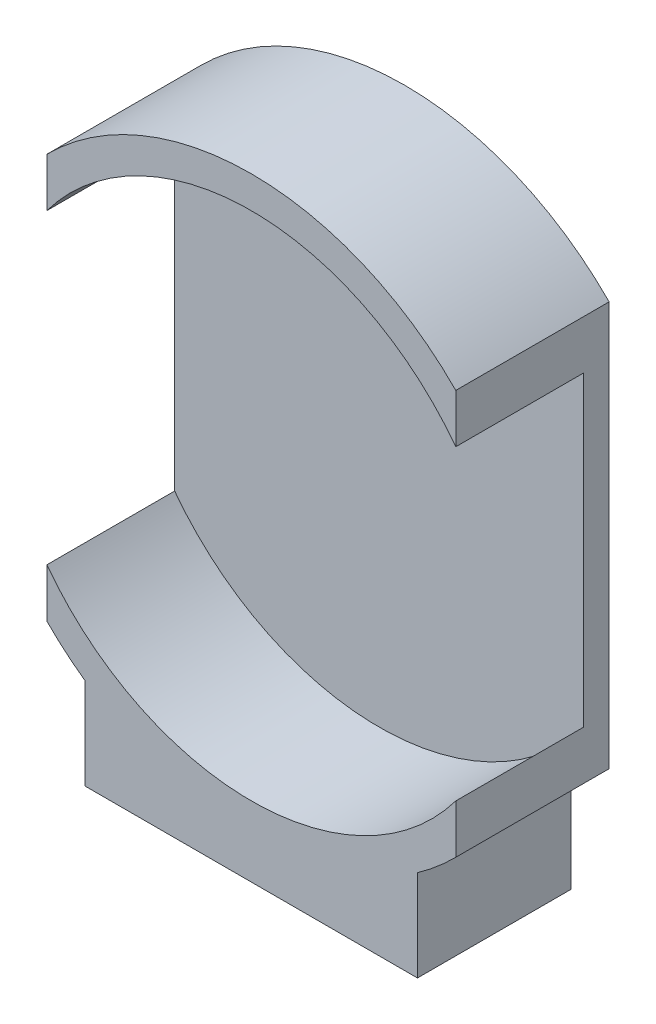
from build123d import *

# Parameters (mm, degrees)
SKETCH1_R           = 11.25
BOSS_EXTRUDE1_DEPTH = 6
SKETCH4_W           = 36
SKETCH4_H           = 45
SKETCH4_W_2         = 16
SKETCH4_H_2         = 25
CUT_EXTRUDE3_DEPTH  = 18.003676073
SKETCH5_W           = 13
SKETCH5_H           = 17
BOSS_EXTRUDE2_DEPTH = 6
SKETCH2_R           = 10
CUT_EXTRUDE4_DEPTH  = 5
SKETCH6_W           = 3
SKETCH6_H           = 0.3
BOSS_EXTRUDE3_DEPTH = 1.6


with BuildPart() as part:
    # Sketch1 → Boss-Extrude1 (new body)
    with BuildSketch(Plane.XY):
        Circle(SKETCH1_R)
    extrude(amount=BOSS_EXTRUDE1_DEPTH)

    # Sketch4 → Cut-Extrude3 (cut, through all)
    with BuildSketch(Plane.XY):
        Rectangle(SKETCH4_W, SKETCH4_H)
        Rectangle(SKETCH4_W_2, SKETCH4_H_2, mode=Mode.SUBTRACT)
    extrude(amount=CUT_EXTRUDE3_DEPTH, mode=Mode.SUBTRACT)

    # Sketch5 → Boss-Extrude2 (add)
    with BuildSketch(Plane.XY):
        with Locations((0, -4.25)):
            Rectangle(SKETCH5_W, SKETCH5_H)
    extrude(amount=BOSS_EXTRUDE2_DEPTH)

    # Sketch2 → Cut-Extrude4 (cut)
    with BuildSketch(Plane.XY.offset(6)):
        Circle(SKETCH2_R)
    extrude(amount=-CUT_EXTRUDE4_DEPTH, mode=Mode.SUBTRACT)

    # Sketch6 → Boss-Extrude3 (add)
    with BuildSketch(Plane.XZ.offset(12.75)):
        with Locations((0, 0.15)):
            Rectangle(SKETCH6_W, SKETCH6_H)
    extrude(amount=BOSS_EXTRUDE3_DEPTH)


solid = part.part
